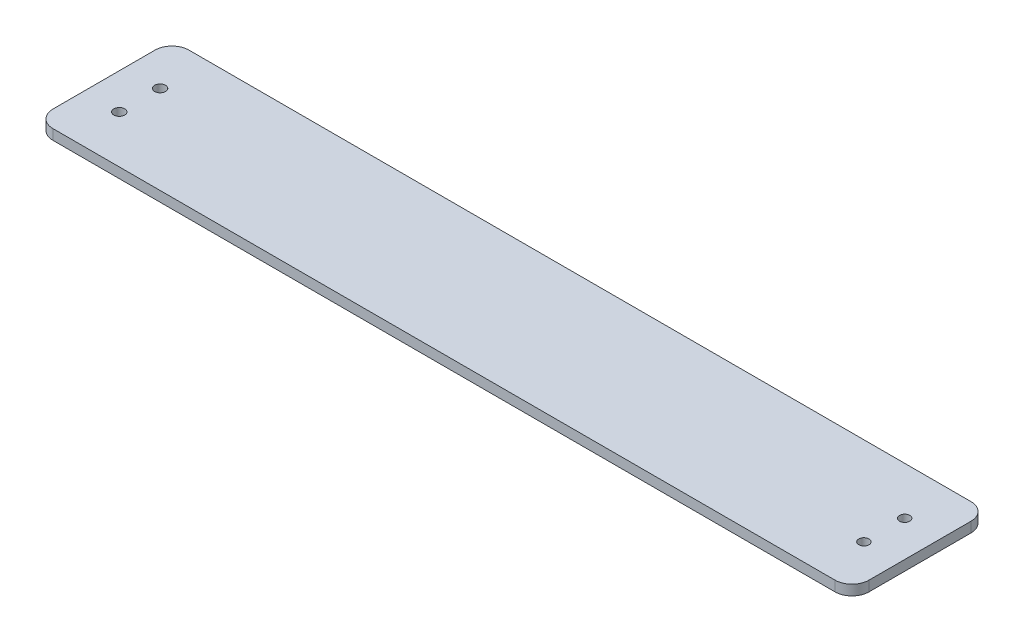
from build123d import *

# Parameters (mm, degrees)
SKETCH_1_R      = 1.6
SKETCH_1_R_2    = 1.5
EXTRUDE_1_DEPTH = 3


with BuildPart() as part:
    # 草图1 → 凸台-拉伸1 (new body)
    with BuildSketch(Plane(origin=(0, 0, 0), x_dir=(1, 0, 0), z_dir=(0, 1, 0))):
        with BuildLine():
            Line((-115, 0), (115, 0))
            ThreePointArc((115, 0), (118.535533906, -1.464466094), (120, -5))
            Line((120, -5), (120, -35))
            ThreePointArc((120, -35), (118.535533906, -38.535533906), (115, -40))
            Line((115, -40), (-115, -40))
            ThreePointArc((-115, -40), (-118.535533906, -38.535533906), (-120, -35))
            Line((-120, -35), (-120, -5))
            ThreePointArc((-120, -5), (-118.535533906, -1.464466094), (-115, 0))
        make_face()
        with Locations(Location((-109.5, -26, 0), (0, 0, 270))):
            Circle(SKETCH_1_R, mode=Mode.SUBTRACT)
        with Locations(Location((109.5, -14, 0), (0, 0, 270))):
            Circle(SKETCH_1_R_2, mode=Mode.SUBTRACT)
        with Locations(Location((109.5, -26, 0), (0, 0, 270))):
            Circle(SKETCH_1_R_2, mode=Mode.SUBTRACT)
        with Locations(Location((-109.5, -14, 0), (0, 0, 270))):
            Circle(SKETCH_1_R, mode=Mode.SUBTRACT)
    extrude(amount=EXTRUDE_1_DEPTH)


solid = part.part
